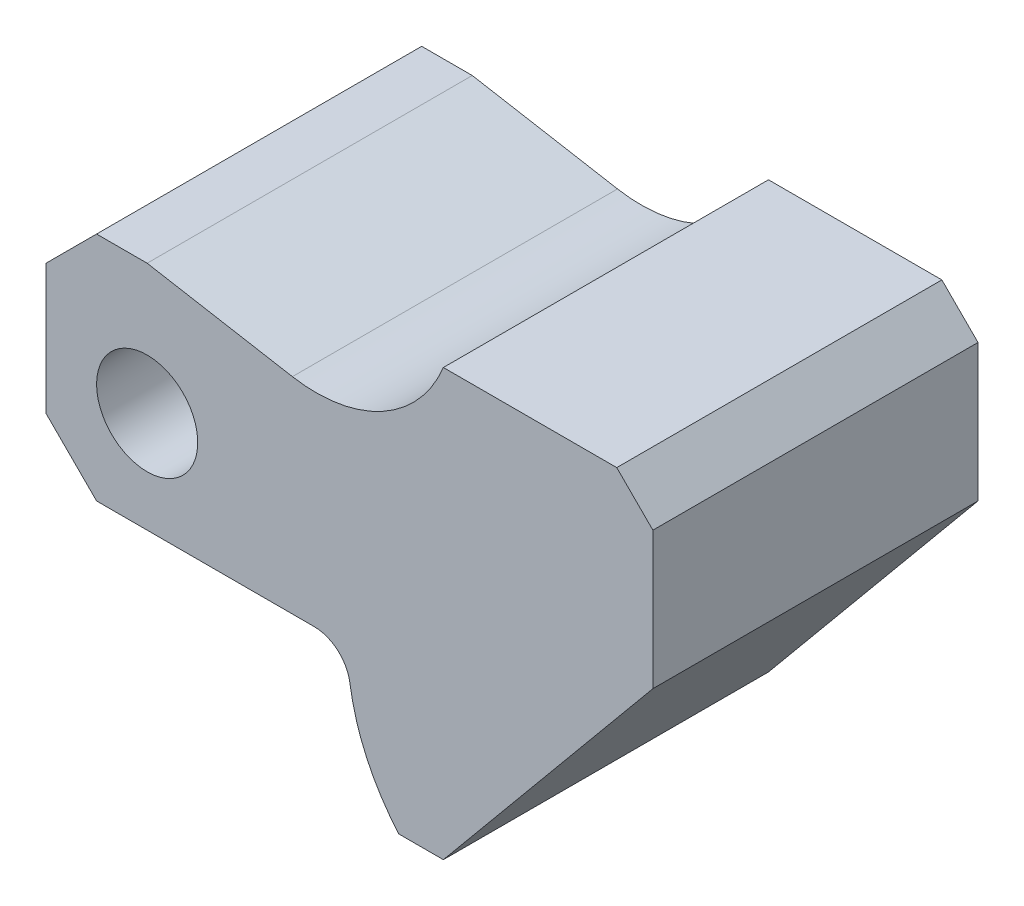
from build123d import *

# Parameters (mm, degrees)
SKETCH1_R           = 7
BOSS_EXTRUDE1_DEPTH = 45


with BuildPart() as part:
    # Sketch1 → Boss-Extrude1 (new body)
    with BuildSketch(Plane.XY):
        with BuildLine():
            Line((0, 7), (0, 25))
            Line((0, 25), (7, 32))
            Line((7, 32), (14, 32))
            Line((14, 32), (34.104042352, 28.455114912))
            ThreePointArc((34.104042352, 28.455114912), (46.591637328, 30.535902458), (55, 40))
            Line((55, 40), (79, 40))
            Line((79, 40), (84, 35))
            Line((84, 35), (84, 16))
            Line((84, 16), (55, -19))
            Line((55, -19), (48.833954843, -19))
            ThreePointArc((48.833954843, -19), (44.394982646, -12.115672061), (42.058152443, -4.264705882))
            ThreePointArc((42.058152443, -4.264705882), (40.377749482, -1.213413768), (37.112513701, 0))
            Line((37.112513701, 0), (7, 0))
            Line((7, 0), (0, 7))
        make_face()
        with Locations(Location((14, 14, 0), (0, 0, 180))):
            Circle(SKETCH1_R, mode=Mode.SUBTRACT)
    extrude(amount=BOSS_EXTRUDE1_DEPTH)


solid = part.part
